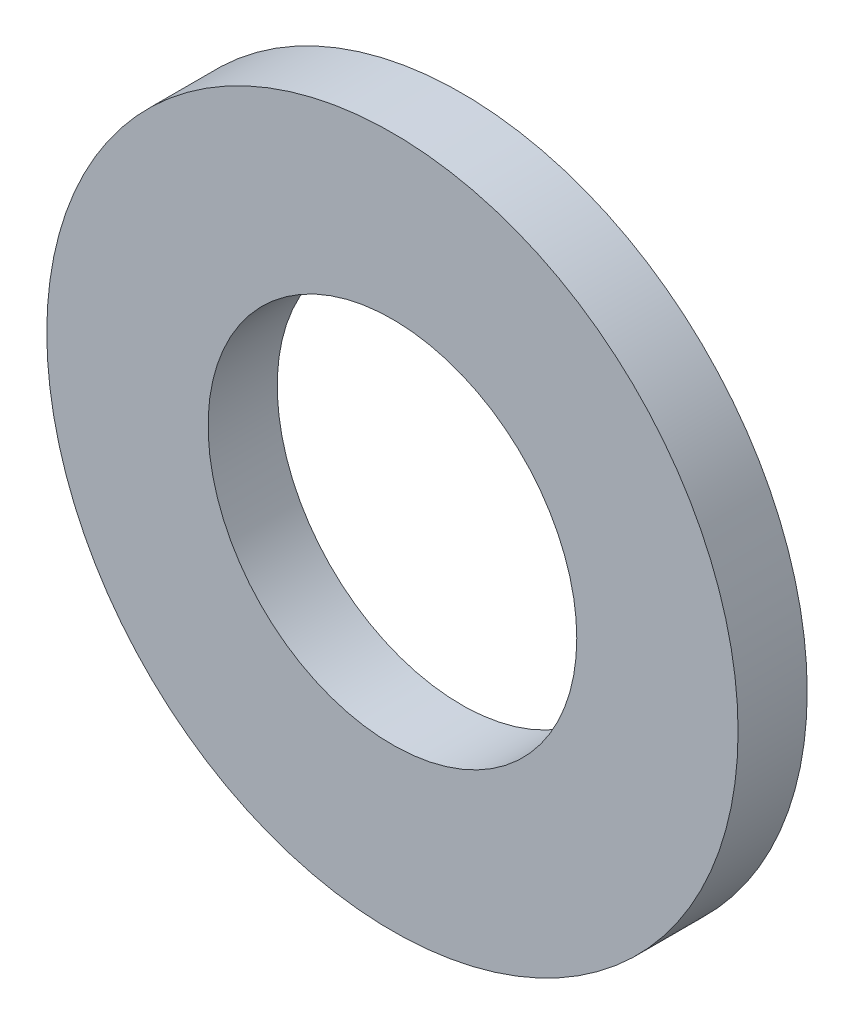
from build123d import *

# Parameters (mm, degrees)
BOSS_EXTRUDE1_DEPTH      = 0.3
BOSS_EXTRUDE1_DEPTH_BACK = 0.3
SKETCH3_R                = 3
SKETCH3_R_2              = 1.6


with BuildPart() as part:
    # Sketch3 → Boss-Extrude1 (new, two sides: drawn at the far end of the back side and taken through both)
    with BuildSketch(Plane.XY.offset(-BOSS_EXTRUDE1_DEPTH_BACK)):
        Circle(SKETCH3_R)
        Circle(SKETCH3_R_2, mode=Mode.SUBTRACT)
    extrude(amount=BOSS_EXTRUDE1_DEPTH + BOSS_EXTRUDE1_DEPTH_BACK)


solid = part.part
